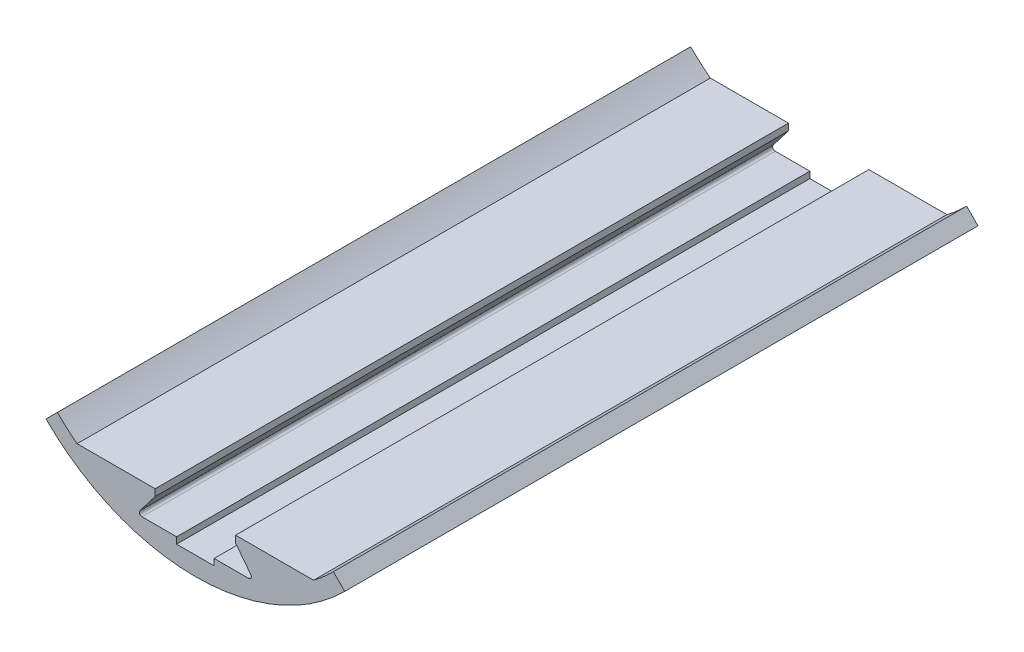
from build123d import *

# Parameters (mm, degrees)
BOSS_EXTRUDE1_DEPTH = 150
BOSS_EXTRUDE2_DEPTH = 150


with BuildPart() as part:
    # Sketch1 → Boss-Extrude1 (new body)
    with BuildSketch(Plane.XY):
        with BuildLine():
            Line((32.688132281, -32.688132281), (35.382209117, -35.382209117))
            ThreePointArc((35.382209117, -35.382209117), (0, -50.038), (-35.382209117, -35.382209117))
            Line((-35.382209117, -35.382209117), (-32.688132281, -32.688132281))
            ThreePointArc((-32.688132281, -32.688132281), (0, -46.228), (32.688132281, -32.688132281))
        make_face()
    extrude(amount=-BOSS_EXTRUDE1_DEPTH)

    # Sketch2 → Boss-Extrude2 (add)
    with BuildSketch(Plane.XY):
        with BuildLine():
            Line((-9.525, -36.775), (-28.011200599, -36.775))
            ThreePointArc((-28.011200599, -36.775), (-14.781631913, -43.801042704), (0, -46.228))
            Line((0, -46.228), (0, -45.609510869))
            Line((0, -45.609510869), (-4.445, -45.609510869))
            Line((-4.445, -45.609510869), (-4.445, -44.085510869))
            Line((-4.445, -44.085510869), (-12.622621116, -44.085510869))
            ThreePointArc((-12.622621116, -44.085510869), (-13.192135307, -43.731364187), (-13.126400487, -43.063947362))
            Line((-13.126400487, -43.063947362), (-9.525, -38.370510869))
            Line((-9.525, -38.370510869), (-9.525, -36.775))
        make_face()
        with BuildLine():
            Line((0, -45.609510869), (0, -46.228))
            ThreePointArc((0, -46.228), (14.781631913, -43.801042704), (28.011200599, -36.775))
            Line((28.011200599, -36.775), (9.525, -36.775))
            Line((9.525, -36.775), (9.525, -38.370510869))
            Line((9.525, -38.370510869), (13.126400487, -43.063947362))
            ThreePointArc((13.126400487, -43.063947362), (13.192135307, -43.731364187), (12.622621116, -44.085510869))
            Line((12.622621116, -44.085510869), (4.445, -44.085510869))
            Line((4.445, -44.085510869), (4.445, -45.609510869))
            Line((4.445, -45.609510869), (0, -45.609510869))
        make_face()
    extrude(amount=-BOSS_EXTRUDE2_DEPTH)


solid = part.part
